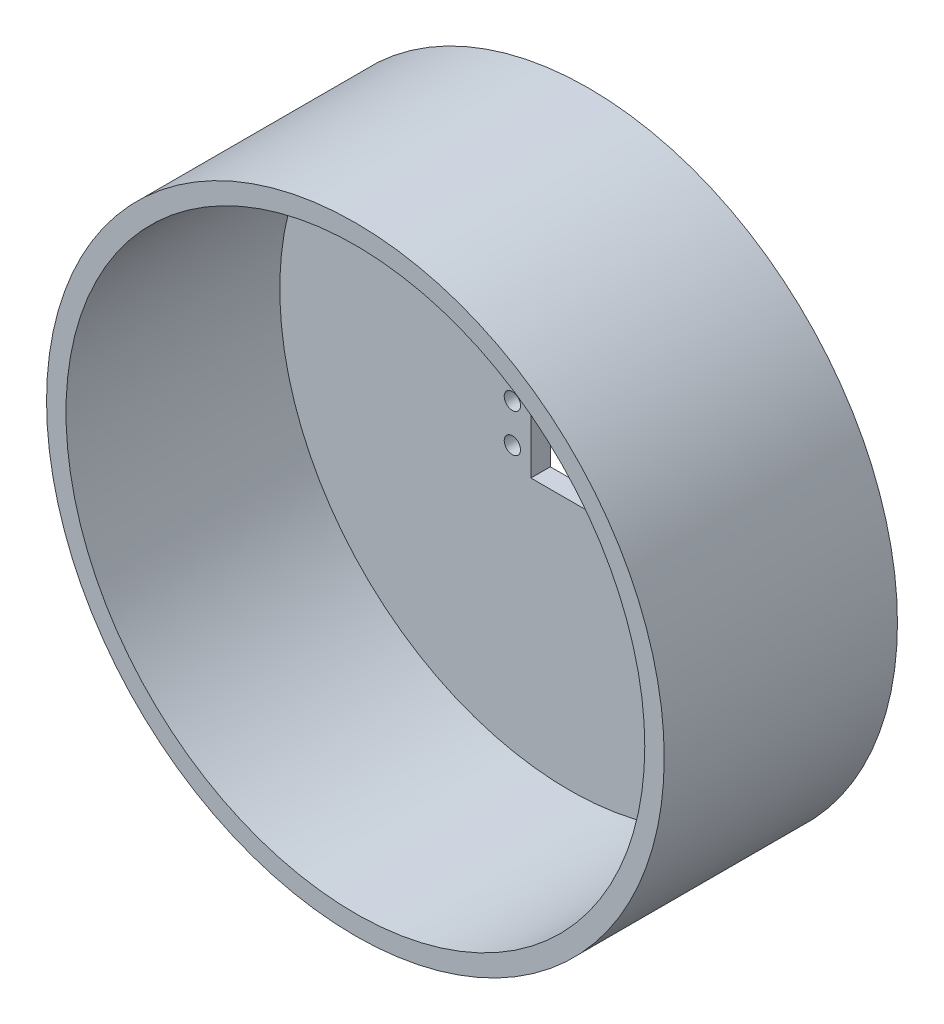
from build123d import *

# Parameters (mm, degrees)
SKETCH1_R           = 79.45
BOSS_EXTRUDE1_DEPTH = 60
SHELL1_T            = -5
SKETCH2_R           = 2.5
CUT_EXTRUDE1_DEPTH  = 60
SKETCH3_R           = 2.1
CUT_EXTRUDE2_DEPTH  = 60


with BuildPart() as part:
    # Sketch1 → Boss-Extrude1 (new body)
    with BuildSketch(Plane.XY):
        Circle(SKETCH1_R)
    extrude(amount=BOSS_EXTRUDE1_DEPTH)

    # Shell1
    shell1_openings = [part.faces().sort_by_distance(p)[0] for p in [
        (0, 0, 60),
    ]]
    offset(amount=SHELL1_T, openings=shell1_openings, kind=Kind.INTERSECTION)

    # Sketch2 → Cut-Extrude1 (cut)
    with BuildSketch(Plane.XY.offset(5)):
        Circle(SKETCH2_R)
    extrude(amount=-CUT_EXTRUDE1_DEPTH, mode=Mode.SUBTRACT)

    # Sketch3 → Cut-Extrude2 (cut)
    with BuildSketch(Plane(origin=(0, 0, 0), x_dir=(-1, 0, 0), z_dir=(0, 0, -1))):
        with Locations((-34.810395013, 4.930302556)):
            Circle(SKETCH3_R)
        with Locations((-34.811895415, -4.91969733)):
            Circle(SKETCH3_R)
        with Locations((14.610395247, -4.927225588)):
            Circle(SKETCH3_R)
        with Locations((14.61189565, 4.922774298)):
            Circle(SKETCH3_R)
        Polygon((-30.048499249, 9.854577256), (9.851454591, 9.84849949), (9.851454591, -9.851500739), (-30.051500054, -9.845422515), align=None)
    extrude(amount=-CUT_EXTRUDE2_DEPTH, mode=Mode.SUBTRACT)


solid = part.part
